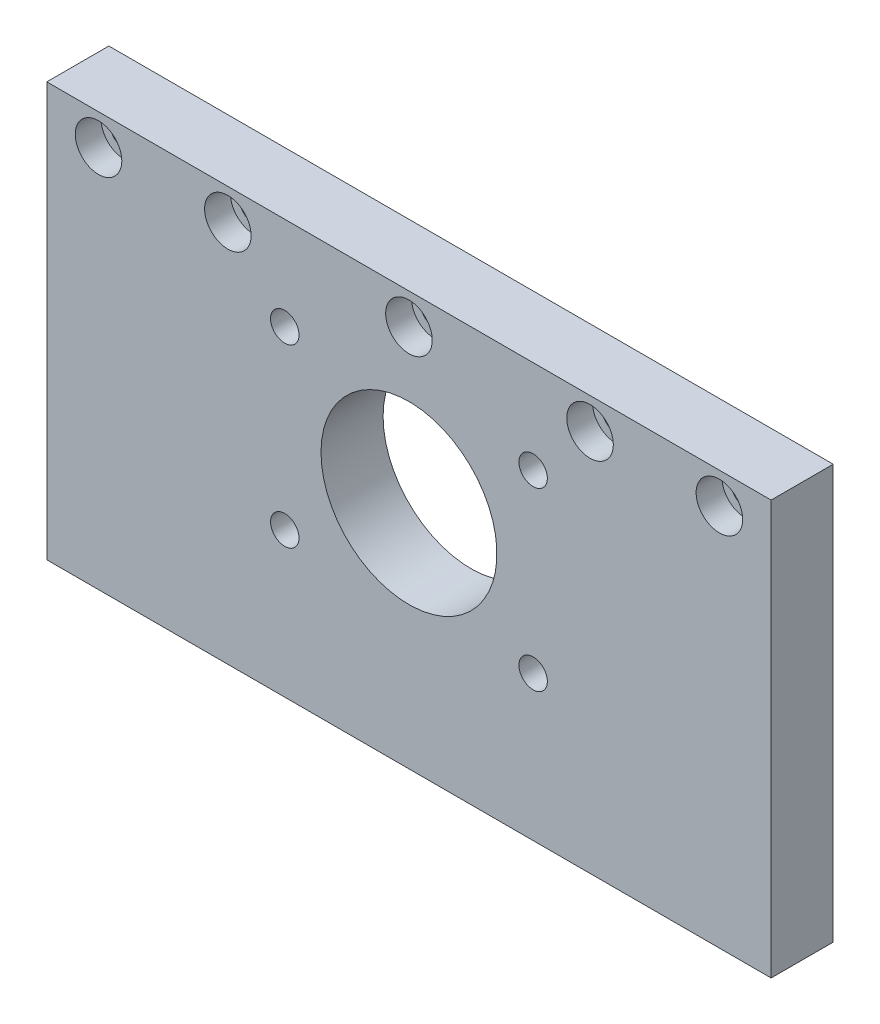
from build123d import *

# Parameters (mm, degrees)
SZKIC1_W                                             = 140
SZKIC1_H                                             = 80
DODANIE_WYCI_GNI_CIE1_DEPTH                          = 12
POG_BIENIE_WALCOWE_POD_M5_WKR_T_DO_CZ_CI_D           = 5.5
POG_BIENIE_WALCOWE_POD_M5_WKR_T_DO_CZ_CI_CBORE_D     = 9
POG_BIENIE_WALCOWE_POD_M5_WKR_T_DO_CZ_CI_CBORE_DEPTH = 5
SZKIC4_R                                             = 17
WYTNIJ_WYCI_GNI_CIE1_DEPTH                           = 156.669521744
POG_BIENIE_WALCOWE_POD_M5_WKR_T_DO_C_2_D             = 5.5
POG_BIENIE_WALCOWE_POD_M5_WKR_T_DO_C_2_CBORE_D       = 9
POG_BIENIE_WALCOWE_POD_M5_WKR_T_DO_C_2_CBORE_DEPTH   = 6


with BuildPart() as part:
    # Szkic1 → Dodanie-wyciągnięcie1 (new body)
    with BuildSketch(Plane.XY):
        with Locations((-70, -27)):
            Rectangle(SZKIC1_W, SZKIC1_H)
    extrude(amount=DODANIE_WYCI_GNI_CIE1_DEPTH)

    # Pog_bienie walcowe pod M5 Wkr_t do cz_ci (through all)
    with Locations(Plane.XY.offset(12)):
        with Locations((-10, 7), (-35, 7), (-105, 7), (-130, 7), (-70, 7)):
            CounterBoreHole(POG_BIENIE_WALCOWE_POD_M5_WKR_T_DO_CZ_CI_D / 2, POG_BIENIE_WALCOWE_POD_M5_WKR_T_DO_CZ_CI_CBORE_D / 2, POG_BIENIE_WALCOWE_POD_M5_WKR_T_DO_CZ_CI_CBORE_DEPTH)

    # Szkic4 → Wytnij-wyciągnięcie1 (cut, through all)
    with BuildSketch(Plane(origin=(0, 0, 0), x_dir=(-1, 0, 0), z_dir=(0, 0, -1))):
        with Locations((70, -22.5)):
            Circle(SZKIC4_R)
    extrude(amount=-WYTNIJ_WYCI_GNI_CIE1_DEPTH, mode=Mode.SUBTRACT)

    # Pog_bienie walcowe pod M5 Wkr_t do c 2 (through all)
    with Locations(Plane(origin=(0, 0, 0), x_dir=(-1, 0, 0), z_dir=(0, 0, -1))):
        with Locations((46, -39), (46, -5)):
            pog_bienie_walcowe_pod_m5_wkr_t_do_c_2 = CounterBoreHole(POG_BIENIE_WALCOWE_POD_M5_WKR_T_DO_C_2_D / 2, POG_BIENIE_WALCOWE_POD_M5_WKR_T_DO_C_2_CBORE_D / 2, POG_BIENIE_WALCOWE_POD_M5_WKR_T_DO_C_2_CBORE_DEPTH)

    # Lustro1: Pog_bienie walcowe pod M5 Wkr_t do c 2 across plane
    add(pog_bienie_walcowe_pod_m5_wkr_t_do_c_2.mirror(Plane.ZY.offset(70)), mode=Mode.SUBTRACT)


solid = part.part
